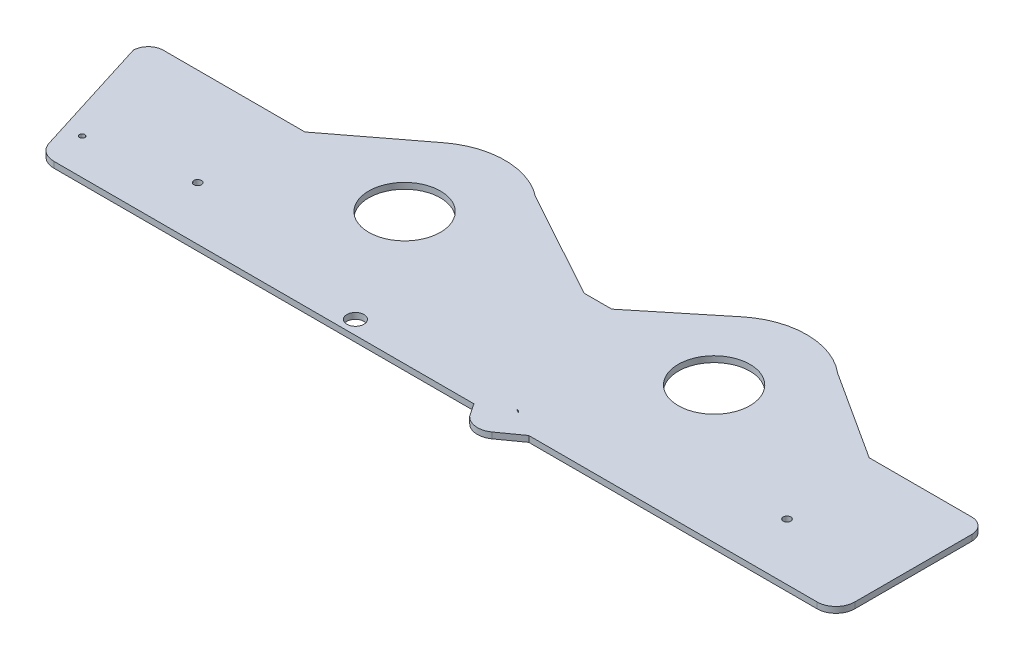
from build123d import *

# Parameters (mm, degrees)
SKETCH1_R                = 4.50864138
SKETCH1_R_2              = 2
SKETCH1_R_3              = 4.6
SKETCH1_R_4              = 1.429414062
BOSS_EXTRUDE1_DEPTH      = 3.175
SKETCH2_W                = 597.466303312
SKETCH2_H                = 60.972543052
CUT_EXTRUDE1_DEPTH       = 70
FILLET1_R                = 10
FILLET2_R                = 10
SKETCH6_R                = 40
BOSS_EXTRUDE2_DEPTH      = 3.175
BOSS_EXTRUDE3_DEPTH      = 3.175
SKETCH9_R                = 40
BOSS_EXTRUDE4_DEPTH      = 3.175
BOSS_EXTRUDE6_DEPTH      = 3.175
SKETCH13_R               = 19
CUT_EXTRUDE5_DEPTH       = 10
SKETCH14_R               = 19
CUT_EXTRUDE6_DEPTH       = 10
BOSS_EXTRUDE7_DEPTH      = 10
BOSS_EXTRUDE7_DEPTH_BACK = 3.175
SKETCH16_W               = 39.380598922
SKETCH16_H               = 33.904845405
CUT_EXTRUDE7_DEPTH       = 10


with BuildPart() as part:
    # Sketch1 → Boss-Extrude1 (new body)
    with BuildSketch(Plane(origin=(0, 0, 0), x_dir=(1, 0, 0), z_dir=(0, 1, 0))):
        with BuildLine():
            ThreePointArc((8, 150), (2.343145751, 147.656854249), (0, 142))
            Line((0, 142), (42, 8))
            ThreePointArc((42, 8), (44.343145751, 2.343145751), (50, 0))
            Line((50, 0), (436.5, 0))
            ThreePointArc((436.5, 0), (442.156854249, 2.343145751), (444.5, 8))
            Line((444.5, 8), (444.5, 142))
            ThreePointArc((444.5, 142), (442.156854249, 147.656854249), (436.5, 150))
            Line((436.5, 150), (338.059360585, 150))
            ThreePointArc((338.059360585, 150), (334.223325972, 144.782574379), (330.387291359, 150))
            Line((330.387291359, 150), (282.940349401, 150))
            ThreePointArc((282.940349401, 150), (281.106475607, 148.798064477), (279.272601814, 150))
            Line((279.272601814, 150), (172.868406334, 150))
            ThreePointArc((172.868406334, 150), (172.5, 146.64039861), (172.131593666, 150))
            Line((172.131593666, 150), (123.116119719, 150))
            ThreePointArc((123.116119719, 150), (122, 146.34039861), (120.883880281, 150))
            Line((120.883880281, 150), (8, 150))
        make_face()
        with Locations(Location((182.429479385, 77.355745695, 0), (0, 0, 270))):
            Circle(SKETCH1_R, mode=Mode.SUBTRACT)
        with Locations(Location((388.475756445, 100.077126905, 0), (0, 0, 270))):
            Circle(SKETCH1_R_2, mode=Mode.SUBTRACT)
        with Locations(Location((265.281257274, 74.563866981, 0), (0, 0, 270))):
            Circle(SKETCH1_R_3, mode=Mode.SUBTRACT)
        with Locations(Location((25.854352659, 89.089252974, 0), (0, 0, 270))):
            Circle(SKETCH1_R_4, mode=Mode.SUBTRACT)
        with Locations(Location((77.821750814, 98.327219393, 0), (0, 0, 270))):
            Circle(SKETCH1_R_2, mode=Mode.SUBTRACT)
    extrude(amount=BOSS_EXTRUDE1_DEPTH)

    # Sketch2 → Cut-Extrude1 (cut)
    with BuildSketch(Plane.XY):
        with Locations((220.1785332, 7.544358636)):
            Rectangle(SKETCH2_W, SKETCH2_H)
    extrude(amount=-CUT_EXTRUDE1_DEPTH, mode=Mode.SUBTRACT)

    # Fillet1
    fillet1_edges = [part.edges().sort_by_distance(p)[0] for p in [
        (22.567164179, 1.5875, -70),
    ]]
    fillet(fillet1_edges, radius=FILLET1_R)

    # Fillet2
    fillet2_edges = [part.edges().sort_by_distance(p)[0] for p in [
        (444.5, 1.5875, -70),
    ]]
    fillet(fillet2_edges, radius=FILLET2_R)

    # Sketch6 → Boss-Extrude2 (add)
    with BuildSketch(Plane(origin=(0, 0, 0), x_dir=(1, 0, 0), z_dir=(0, 1, 0))):
        with Locations((149, 150.04039861)):
            Circle(SKETCH6_R)
    extrude(amount=BOSS_EXTRUDE2_DEPTH)

    # Sketch7 → Boss-Extrude3 (add)
    with BuildSketch(Plane(origin=(0, 0, 0), x_dir=(1, 0, 0), z_dir=(0, 1, 0))):
        Polygon((124.164543783, 181.396420591), (82.702881078, 149.750534228), (231.468946681, 149.750534228), (173.835456217, 181.396420591), align=None)
    extrude(amount=BOSS_EXTRUDE3_DEPTH)

    # Sketch9 → Boss-Extrude4 (add)
    with BuildSketch(Plane(origin=(0, 0, 0), x_dir=(1, 0, 0), z_dir=(0, 1, 0))):
        with BuildLine():
            ThreePointArc((269, 150), (272.870833001, 167.166341835), (283.734164599, 181.010281545))
            Line((283.734164599, 181.010281545), (245.673378314, 150))
            Line((245.673378314, 150), (269, 150))
        make_face()
        with Locations((309, 150)):
            Circle(SKETCH9_R)
    extrude(amount=BOSS_EXTRUDE4_DEPTH)

    # Sketch12 → Boss-Extrude6 (add)
    with BuildSketch(Plane(origin=(0, 0, 0), x_dir=(1, 0, 0), z_dir=(0, 1, 0))):
        Polygon((326.166341835, 186.129166999), (382.106475607, 150), (340.398839744, 150), align=None)
    extrude(amount=BOSS_EXTRUDE6_DEPTH)

    # Sketch13 → Cut-Extrude5 (cut)
    with BuildSketch(Plane(origin=(0, 3.175, 0), x_dir=(1, 0, 0), z_dir=(0, 1, 0))):
        with Locations(Location((146, 139.84039861, 0), (0, 0, 270))):
            Circle(SKETCH13_R)
    extrude(amount=-CUT_EXTRUDE5_DEPTH, mode=Mode.SUBTRACT)

    # Sketch14 → Cut-Extrude6 (cut)
    with BuildSketch(Plane(origin=(0, 3.175, 0), x_dir=(1, 0, 0), z_dir=(0, 1, 0))):
        with Locations(Location((307.606475607, 142.298064477, 0), (0, 0, 270))):
            Circle(SKETCH14_R)
    extrude(amount=-CUT_EXTRUDE6_DEPTH, mode=Mode.SUBTRACT)

    # Sketch15 → Boss-Extrude7 (add, two sides: drawn at the far end of the back side and taken through both)
    with BuildSketch(Plane(origin=(0, 3.175, 0), x_dir=(1, 0, 0), z_dir=(0, 1, 0)).offset(-BOSS_EXTRUDE7_DEPTH_BACK)):
        with BuildLine():
            Line((270.323640372, 61.870718801), (281.671389991, 70))
            Line((281.671389991, 70), (265.856685963, 70))
            ThreePointArc((265.856685963, 70), (269.551101507, 72.852601302), (268.849345077, 77.467097842))
            Line((268.849345077, 77.467097842), (266.045546336, 79.099929396))
            ThreePointArc((266.045546336, 79.099929396), (260.730312777, 75.233870106), (264.705828584, 70))
            Line((264.705828584, 70), (252.589726142, 70))
            Line((252.589726142, 70), (257.164027826, 63.204154779))
            ThreePointArc((257.164027826, 63.204154779), (263.491883069, 60.050944756), (270.323640372, 61.870718801))
        make_face()
    extrude(amount=BOSS_EXTRUDE7_DEPTH + BOSS_EXTRUDE7_DEPTH_BACK)

    # Sketch16 → Cut-Extrude7 (cut)
    with BuildSketch(Plane(origin=(0, 13.175, 0), x_dir=(1, 0, 0), z_dir=(0, 1, 0))):
        with Locations((267.135263248, 68.050551455)):
            Rectangle(SKETCH16_W, SKETCH16_H)
    extrude(amount=-CUT_EXTRUDE7_DEPTH, mode=Mode.SUBTRACT)


solid = part.part
